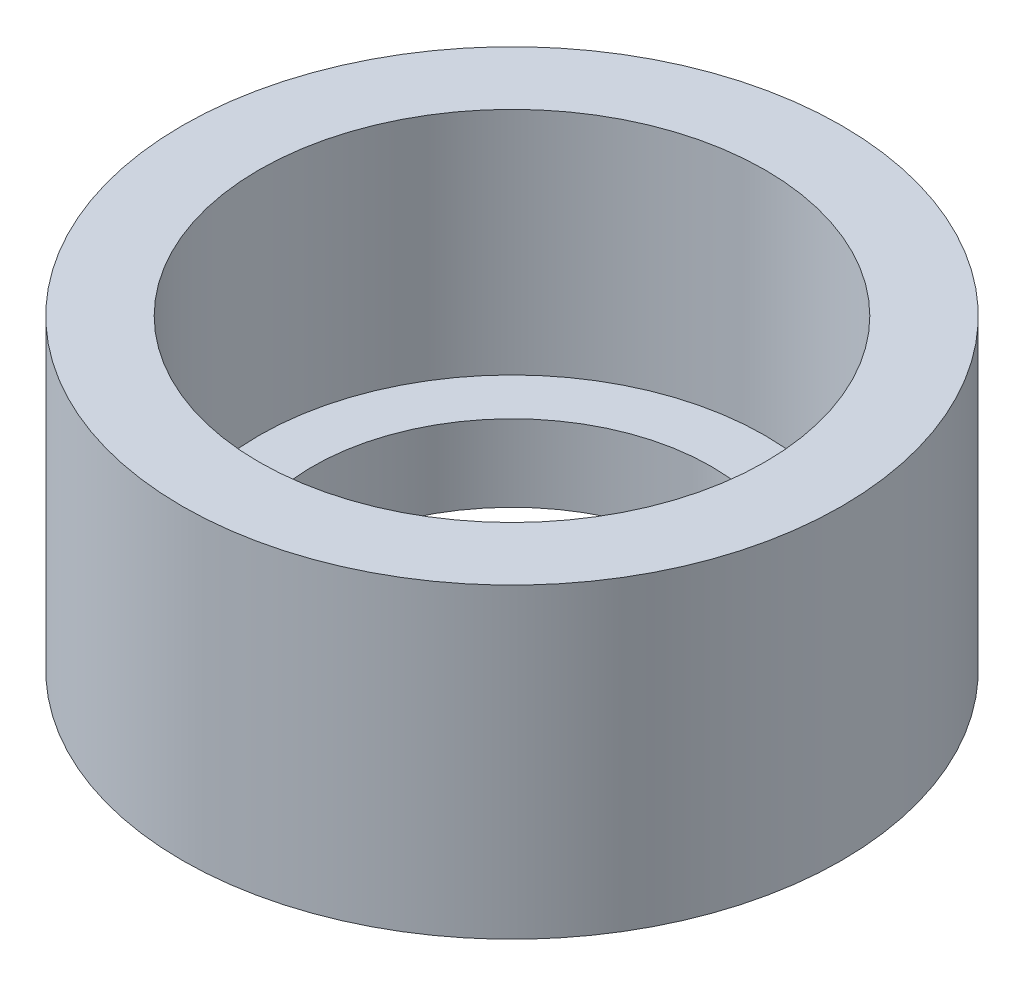
from build123d import *

# Parameters (mm, degrees)
SKETCH1_W   = 1.7
SKETCH1_H   = 1
SKETCH1_W_2 = 1
SKETCH1_H_2 = 3


with BuildPart() as part:
    # Sketch1 → Revolve2 (revolve)
    with BuildSketch(Plane.XY, mode=Mode.PRIVATE) as revolve2_sk:
        with Locations((3.45, 0.5)):
            Rectangle(SKETCH1_W, SKETCH1_H)
        with Locations((3.8, 2.5)):
            Rectangle(SKETCH1_W_2, SKETCH1_H_2)
    revolve(revolve2_sk.sketch.rotate(Axis((0, 0, 0), (0, 1, 0)), 90), axis=Axis((0, 0, 0), (0, 1, 0)))


solid = part.part
